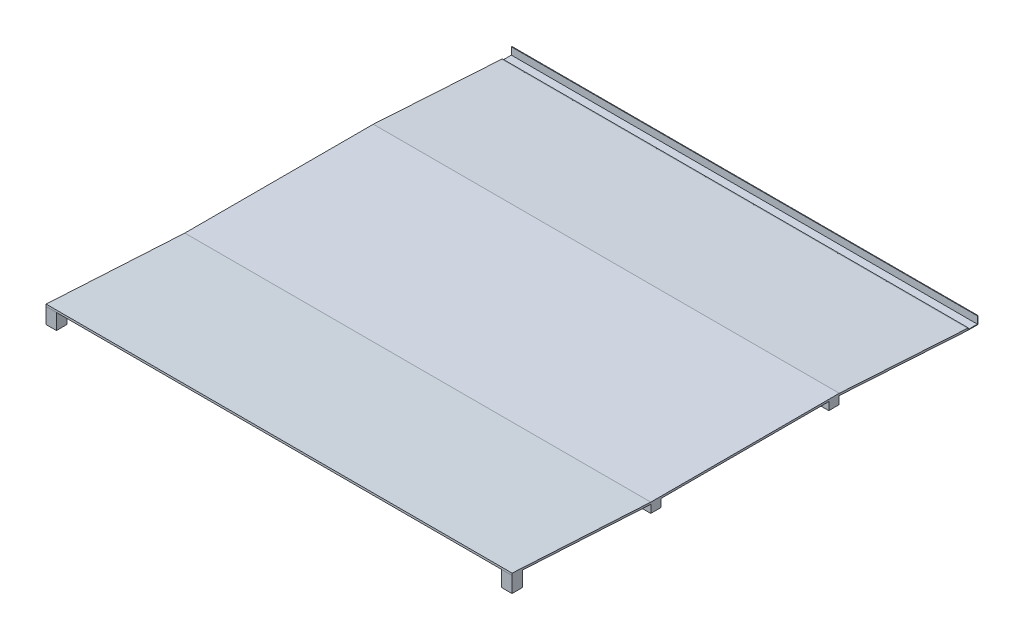
from build123d import *

# Parameters (mm, degrees)
EXTRUDE_THIN1_DEPTH = 4521.2
BOSS_EXTRUDE1_REACH = 3203.564
SKETCH3_W           = 101.6
SKETCH3_H           = 101.6
BOSS_EXTRUDE2_REACH = 3200.389
SKETCH4_W           = 101.6
SKETCH4_H           = 101.6
BOSS_EXTRUDE3_DEPTH = 4521.2


with BuildPart() as part:
    # Sketch2 → Extrude-Thin1 (new body)
    with BuildSketch(Plane.ZY.offset(-2260.6)):
        Polygon((-2159, 0), (-914.4, 76.2), (914.4, 76.2), (2260.6, 152.4), (2259.523421406, 171.419555161), (913.861280224, 95.25), (-914.982617799, 95.25), (-2160.164146705, 19.014396189), align=None)
    extrude(amount=EXTRUDE_THIN1_DEPTH)

    # Boss-Extrude1: up to this face of the body (flat: up to its plane)
    boss_extrude1_end = Plane(part.part.faces().sort_by_distance((0, 76.2, 0))[0])
    # Sketch3 → Boss-Extrude1 (add, up to the picked face)
    with BuildSketch(Plane(origin=(0, 0, 0), x_dir=(1, 0, 0), z_dir=(0, 1, 0)), mode=Mode.PRIVATE) as boss_extrude1_sk1:
        with Locations((2209.8, -2209.8)):
            Rectangle(SKETCH3_W, SKETCH3_H)
    boss_extrude1_tool1 = split(extrude(boss_extrude1_sk1.sketch, amount=BOSS_EXTRUDE1_REACH, mode=Mode.PRIVATE), bisect_by=boss_extrude1_end, keep=Keep.BOTH, mode=Mode.PRIVATE)
    # Sketch3 → Boss-Extrude1 (add, up to the picked face)
    with BuildSketch(Plane(origin=(0, 0, 0), x_dir=(1, 0, 0), z_dir=(0, 1, 0)), mode=Mode.PRIVATE) as boss_extrude1_sk2:
        with Locations((-2209.8, -2209.8)):
            Rectangle(SKETCH3_W, SKETCH3_H)
    boss_extrude1_tool2 = split(extrude(boss_extrude1_sk2.sketch, amount=BOSS_EXTRUDE1_REACH, mode=Mode.PRIVATE), bisect_by=boss_extrude1_end, keep=Keep.BOTH, mode=Mode.PRIVATE)
    # Sketch3 → Boss-Extrude1 (add, up to the picked face)
    with BuildSketch(Plane(origin=(0, 0, 0), x_dir=(1, 0, 0), z_dir=(0, 1, 0)), mode=Mode.PRIVATE) as boss_extrude1_sk3:
        with Locations((-2209.8, -863.6)):
            Rectangle(SKETCH3_W, SKETCH3_H)
    boss_extrude1_tool3 = split(extrude(boss_extrude1_sk3.sketch, amount=BOSS_EXTRUDE1_REACH, mode=Mode.PRIVATE), bisect_by=boss_extrude1_end, keep=Keep.BOTH, mode=Mode.PRIVATE)
    # Sketch3 → Boss-Extrude1 (add, up to the picked face)
    with BuildSketch(Plane(origin=(0, 0, 0), x_dir=(1, 0, 0), z_dir=(0, 1, 0)), mode=Mode.PRIVATE) as boss_extrude1_sk4:
        with Locations((-2209.8, 863.6)):
            Rectangle(SKETCH3_W, SKETCH3_H)
    boss_extrude1_tool4 = split(extrude(boss_extrude1_sk4.sketch, amount=BOSS_EXTRUDE1_REACH, mode=Mode.PRIVATE), bisect_by=boss_extrude1_end, keep=Keep.BOTH, mode=Mode.PRIVATE)
    # Sketch3 → Boss-Extrude1 (add, up to the picked face)
    with BuildSketch(Plane(origin=(0, 0, 0), x_dir=(1, 0, 0), z_dir=(0, 1, 0)), mode=Mode.PRIVATE) as boss_extrude1_sk5:
        with Locations((2209.8, 863.6)):
            Rectangle(SKETCH3_W, SKETCH3_H)
    boss_extrude1_tool5 = split(extrude(boss_extrude1_sk5.sketch, amount=BOSS_EXTRUDE1_REACH, mode=Mode.PRIVATE), bisect_by=boss_extrude1_end, keep=Keep.BOTH, mode=Mode.PRIVATE)
    # Sketch3 → Boss-Extrude1 (add, up to the picked face)
    with BuildSketch(Plane(origin=(0, 0, 0), x_dir=(1, 0, 0), z_dir=(0, 1, 0)), mode=Mode.PRIVATE) as boss_extrude1_sk6:
        with Locations((2209.8, -863.6)):
            Rectangle(SKETCH3_W, SKETCH3_H)
    boss_extrude1_tool6 = split(extrude(boss_extrude1_sk6.sketch, amount=BOSS_EXTRUDE1_REACH, mode=Mode.PRIVATE), bisect_by=boss_extrude1_end, keep=Keep.BOTH, mode=Mode.PRIVATE)
    add(boss_extrude1_tool1.solids().sort_by(Axis((2209.8, 0, 2209.8), (0, 1, 0)))[0])
    add(boss_extrude1_tool2.solids().sort_by(Axis((-2209.8, 0, 2209.8), (0, 1, 0)))[0])
    add(boss_extrude1_tool3.solids().sort_by(Axis((-2209.8, 0, 863.6), (0, 1, 0)))[0])
    add(boss_extrude1_tool4.solids().sort_by(Axis((-2209.8, 0, -863.6), (0, 1, 0)))[0])
    add(boss_extrude1_tool5.solids().sort_by(Axis((2209.8, 0, -863.6), (0, 1, 0)))[0])
    add(boss_extrude1_tool6.solids().sort_by(Axis((2209.8, 0, 863.6), (0, 1, 0)))[0])


with BuildPart() as boss_extrude1_piece_1:
    # of the separate pieces the step leaves, piece 1, a body of its own (boss_extrude1_pieces)
    add(part.part.solids().sort_by_distance((2260.6, 0, -2159))[0])



with BuildPart() as boss_extrude1_piece_2:
    # of the separate pieces the step leaves, piece 2, a body of its own (boss_extrude1_pieces)
    add(part.part.solids().sort_by_distance((-2260.6, 0, 2260.6))[0])


with BuildPart() as boss_extrude1_piece_3:
    # of the separate pieces the step leaves, piece 3, a body of its own (boss_extrude1_pieces)
    add(part.part.solids().sort_by_distance((2260.6, 0, 2260.6))[0])


with BuildPart() as boss_extrude1_piece_1_1:
    add(boss_extrude1_piece_1.part)

    add(boss_extrude1_piece_2.part)  # Boss-Extrude2 merges Boss-Extrude1 piece 2

    add(boss_extrude1_piece_3.part)  # Boss-Extrude2 merges Boss-Extrude1 piece 3
    # Boss-Extrude2: up to this plane
    boss_extrude2_end = Plane(origin=(-2260.6, 76.2, 914.4), z_dir=(0, 0.9984018457335854, -0.05651331202265579))
    # Sketch4 → Boss-Extrude2 (add, up to the surface)
    with BuildSketch(Plane(origin=(0, 76.2, 0), x_dir=(1, 0, 0), z_dir=(0, 1, 0)), mode=Mode.PRIVATE) as boss_extrude2_sk1:
        with Locations((2209.8, -2209.8)):
            Rectangle(SKETCH4_W, SKETCH4_H)
    boss_extrude2_tool1 = split(extrude(boss_extrude2_sk1.sketch, amount=BOSS_EXTRUDE2_REACH, mode=Mode.PRIVATE), bisect_by=boss_extrude2_end, keep=Keep.BOTH, mode=Mode.PRIVATE)
    add(boss_extrude2_tool1.solids().sort_by_distance((2209.8, 76.2, 2209.8))[0])
    # Sketch4 → Boss-Extrude2 (add, up to the surface)
    with BuildSketch(Plane(origin=(0, 76.2, 0), x_dir=(1, 0, 0), z_dir=(0, 1, 0)), mode=Mode.PRIVATE) as boss_extrude2_sk2:
        with Locations((-2209.8, -2209.8)):
            Rectangle(SKETCH4_W, SKETCH4_H)
    boss_extrude2_tool2 = split(extrude(boss_extrude2_sk2.sketch, amount=BOSS_EXTRUDE2_REACH, mode=Mode.PRIVATE), bisect_by=boss_extrude2_end, keep=Keep.BOTH, mode=Mode.PRIVATE)
    add(boss_extrude2_tool2.solids().sort_by_distance((-2209.8, 76.2, 2209.8))[0])


with BuildPart() as body_2:
    # Sketch5 → Boss-Extrude3 (new body)
    with BuildSketch(Plane.ZY.offset(2260.6)):
        Polygon((-2260.6, 76.2), (-2260.6, 0), (-2160.164146705, 0), (-2160.164146705, 19.05), (-2166.514146705, 19.05), (-2166.514146705, 6.35), (-2254.25, 6.35), (-2254.25, 76.2), align=None)
    extrude(amount=-BOSS_EXTRUDE3_DEPTH)


solid = Compound([boss_extrude1_piece_1_1.part, body_2.part])
